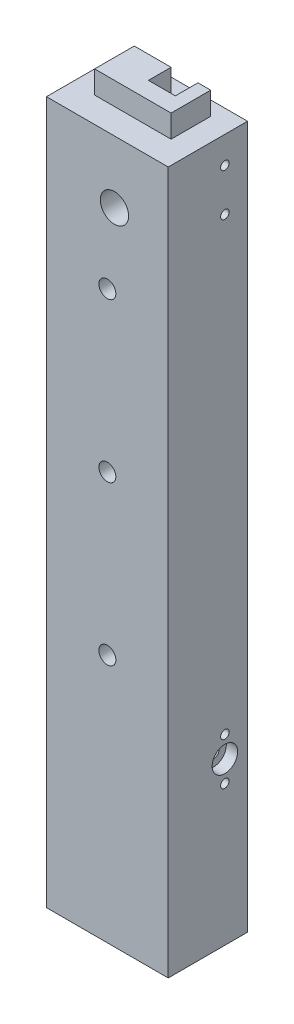
from build123d import *

# Parameters (mm, degrees)
SKETCH1_W           = 136.525
SKETCH1_H           = 787.4
BOSS_EXTRUDE1_DEPTH = 88.9
BOSS_EXTRUDE2_DEPTH = 25.4
SKETCH3_R           = 9.525
SKETCH3_R_2         = 15.875
CUT_EXTRUDE1_DEPTH  = 434.829216289
SKETCH5_W           = 44.45
SKETCH5_H           = 76.2
CUT_EXTRUDE2_DEPTH  = 19.05
SKETCH6_W           = 15.875
SKETCH6_H           = 69.85
SKETCH6_H_2         = 88.9
CUT_EXTRUDE3_DEPTH  = 50.8
SKETCH7_R           = 4.7625
CUT_EXTRUDE4_DEPTH  = 44.45
SKETCH7_3_R         = 6.35
CUT_EXTRUDE5_DEPTH  = 450.652194062
SKETCH8_R           = 14.2875
CUT_EXTRUDE6_DEPTH  = 12.7


with BuildPart() as part:
    # Sketch1 → Boss-Extrude1 (new body)
    with BuildSketch(Plane.XY):
        Rectangle(SKETCH1_W, SKETCH1_H)
    extrude(amount=BOSS_EXTRUDE1_DEPTH)

    # Sketch2 → Boss-Extrude2 (add)
    with BuildSketch(Plane(origin=(0, 393.7, 0), x_dir=(1, 0, 0), z_dir=(0, 1, 0))):
        Polygon((-42.8625, -60.325), (42.8625, -60.325), (42.8625, -15.875), (28.575, -15.875), (28.575, -41.275), (-1.5875, -41.275), (-1.5875, -15.875), (-42.8625, -15.875), align=None)
    extrude(amount=BOSS_EXTRUDE2_DEPTH)

    # Sketch3 → Cut-Extrude1 (cut, through all)
    with BuildSketch(Plane.XY.offset(88.9)):
        with Locations((0, 63.5)):
            Circle(SKETCH3_R)
        with Locations((0, -114.3)):
            Circle(SKETCH3_R)
        with Locations((0, 241.3)):
            Circle(SKETCH3_R)
        with Locations((7.9375, 323.85)):
            Circle(SKETCH3_R_2)
    extrude(amount=-CUT_EXTRUDE1_DEPTH, mode=Mode.SUBTRACT)

    # Sketch5 → Cut-Extrude2 (cut)
    with BuildSketch(Plane.ZY.offset(68.2625)):
        with Locations((38.1, -212.725)):
            Rectangle(SKETCH5_W, SKETCH5_H)
    extrude(amount=-CUT_EXTRUDE2_DEPTH, mode=Mode.SUBTRACT)

    # Sketch6 → Cut-Extrude3 (cut)
    with BuildSketch(Plane(origin=(0, 0, 0), x_dir=(-1, 0, 0), z_dir=(0, 0, -1))):
        with Locations((-46.0375, 339.725)):
            Rectangle(SKETCH6_W, SKETCH6_H)
        with Locations((-46.0375, -212.725)):
            Rectangle(SKETCH6_W, SKETCH6_H_2)
    extrude(amount=-CUT_EXTRUDE3_DEPTH, mode=Mode.SUBTRACT)

    # Sketch7 → Cut-Extrude4 (cut)
    with BuildSketch(Plane(origin=(68.2625, 0, 0), x_dir=(0, 0, -1), z_dir=(1, 0, 0))):
        with Locations((-25.4, -188.9125)):
            Circle(SKETCH7_R)
        with Locations((-25.4, -236.5375)):
            Circle(SKETCH7_R)
        with Locations((-25.4, 363.5375)):
            Circle(SKETCH7_R)
        with Locations((-25.4, 315.9125)):
            Circle(SKETCH7_R)
    extrude(amount=-CUT_EXTRUDE4_DEPTH, mode=Mode.SUBTRACT)

    # Sketch7<3> → Cut-Extrude5 (cut, through all)
    with BuildSketch(Plane(origin=(68.2625, 0, 0), x_dir=(0, 0, -1), z_dir=(1, 0, 0))):
        with Locations((-25.4, -212.725)):
            Circle(SKETCH7_3_R)
    extrude(amount=-CUT_EXTRUDE5_DEPTH, mode=Mode.SUBTRACT)

    # Sketch8 → Cut-Extrude6 (cut)
    with BuildSketch(Plane(origin=(68.2625, 0, 0), x_dir=(0, 0, -1), z_dir=(1, 0, 0))):
        with Locations((-25.4, -212.725)):
            Circle(SKETCH8_R)
    extrude(amount=-CUT_EXTRUDE6_DEPTH, mode=Mode.SUBTRACT)


solid = part.part
